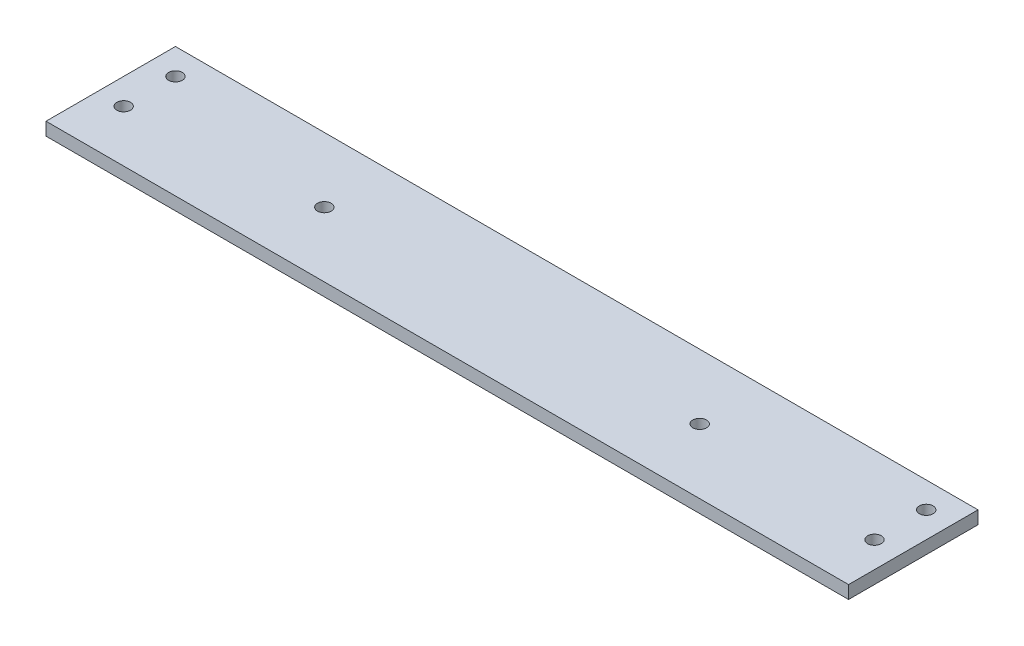
from build123d import *

# Parameters (mm, degrees)
SKETCH1_W           = 393.7
SKETCH1_H           = 63.5
BOSS_EXTRUDE1_DEPTH = 6.35
SKETCH2_R           = 3.3655
SKETCH2_R_2         = 2.5527
CUT_EXTRUDE1_DEPTH  = 200.49513152


with BuildPart() as part:
    # Sketch1 → Boss-Extrude1 (new body)
    with BuildSketch(Plane(origin=(0, 0, 0), x_dir=(1, 0, 0), z_dir=(0, 1, 0))):
        Rectangle(SKETCH1_W, SKETCH1_H)
    extrude(amount=BOSS_EXTRUDE1_DEPTH)

    # Sketch2 → Cut-Extrude1 (cut, through all)
    # profile 1 of 8: a face of its own
    with BuildSketch(Plane.XZ):
        with Locations(Location((-92.062267829, 0, 0), (0, 0, 270))):
            Circle(SKETCH2_R)
        with Locations((-92.062267829, 0)):
            Circle(SKETCH2_R_2, mode=Mode.SUBTRACT)
    # profile 2 of 8: a face of its own
    with BuildSketch(Plane.XZ):
        with Locations((-92.062267829, 0)):
            Circle(SKETCH2_R_2)
    # profile 3 of 8: a face of its own
    with BuildSketch(Plane.XZ):
        with Locations(Location((-184.15, 6.35, 0), (0, 0, 270))):
            Circle(SKETCH2_R)
    # profile 4 of 8: a face of its own
    with BuildSketch(Plane.XZ):
        with Locations(Location((-184.15, -19.05, 0), (0, 0, 270))):
            Circle(SKETCH2_R)
    # profile 5 of 8: a face of its own
    with BuildSketch(Plane.XZ):
        with Locations(Location((92.075, 0, 0), (0, 0, 270))):
            Circle(SKETCH2_R)
        with Locations((92.075, 0)):
            Circle(SKETCH2_R_2, mode=Mode.SUBTRACT)
    # profile 6 of 8: a face of its own
    with BuildSketch(Plane.XZ):
        with Locations((92.075, 0)):
            Circle(SKETCH2_R_2)
    # profile 7 of 8: a face of its own
    with BuildSketch(Plane.XZ):
        with Locations(Location((184.15, 6.35, 0), (0, 0, 270))):
            Circle(SKETCH2_R)
    # profile 8 of 8: a face of its own
    with BuildSketch(Plane.XZ):
        with Locations(Location((184.15, -19.05, 0), (0, 0, 270))):
            Circle(SKETCH2_R)
    extrude(amount=-CUT_EXTRUDE1_DEPTH, mode=Mode.SUBTRACT)


solid = part.part
